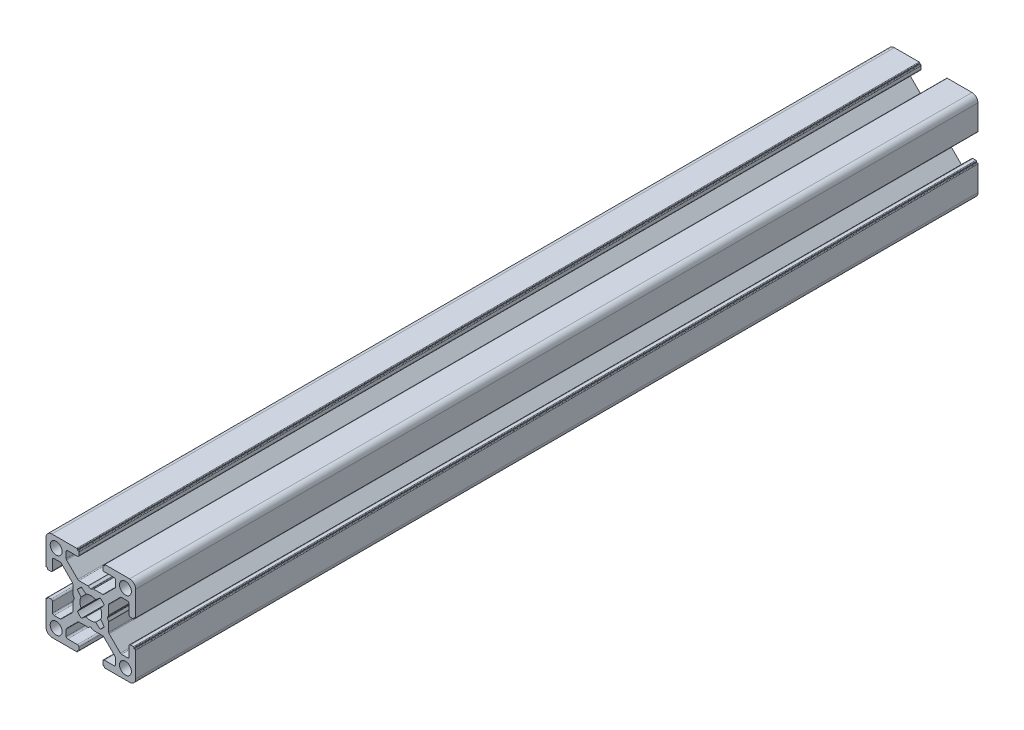
from build123d import *

# Parameters (mm, degrees)
CROQUIS1_R              = 2
SALIENTE_EXTRUIR1_DEPTH = 282


with BuildPart() as part:
    # Croquis1 → Saliente-Extruir1 (new body)
    with BuildSketch(Plane.XY.offset(1000)):
        with BuildLine():
            Line((9.800000436, -10.500000436), (10.100000436, -10.500000436))
            ThreePointArc((10.100000436, -10.500000436), (10.241421792, -10.441421792), (10.300000436, -10.300000436))
            Line((10.300000436, -10.300000436), (10.300000436, -2))
            ThreePointArc((10.300000436, -2), (9.714213998, -0.585786438), (8.300000436, 0))
            Line((8.300000436, 0), (0, 0))
            ThreePointArc((0, 0), (-0.141421356, -0.058578644), (-0.2, -0.2))
            Line((-0.2, -0.2), (-0.2, -0.5))
            Line((-0.2, -0.5), (-0.49999919, -0.5))
            ThreePointArc((-0.49999919, -0.5), (-0.641420811, -0.558578753), (-0.699999564, -0.700000374))
            Line((-0.699999564, -0.700000374), (-0.699999564, -1.700000763))
            ThreePointArc((-0.699999564, -1.700000763), (-0.553552955, -2.053554154), (-0.199999564, -2.200000763))
            Line((-0.199999564, -2.200000763), (3.050000763, -2.200000763))
            ThreePointArc((3.050000763, -2.200000763), (3.403554154, -2.346447372), (3.550000763, -2.700000763))
            Line((3.550000763, -2.700000763), (3.550000763, -4.743055509))
            ThreePointArc((3.550000763, -4.743055509), (3.511993279, -4.934269826), (3.403749103, -5.096413843))
            Line((3.403749103, -5.096413843), (-0.349053376, -8.853358334))
            ThreePointArc((-0.349053376, -8.853358334), (-0.511332616, -8.961886981), (-0.702801716, -9))
            Line((-0.702801716, -9), (-3.746809419, -9))
            ThreePointArc((-3.746809419, -9), (-3.798212795, -9.006718618), (-3.846162576, -9.026423071))
            Line((-3.846162576, -9.026423071), (-4.600646407, -9.458279719))
            ThreePointArc((-4.600646407, -9.458279719), (-4.699999564, -9.48470279), (-4.799352721, -9.458279719))
            Line((-4.799352721, -9.458279719), (-5.553836552, -9.026423071))
            ThreePointArc((-5.553836552, -9.026423071), (-5.601786333, -9.006718618), (-5.653189709, -9))
            Line((-5.653189709, -9), (-8.697197412, -9))
            ThreePointArc((-8.697197412, -9), (-8.888666513, -8.961886981), (-9.050945752, -8.853358334))
            Line((-9.050945752, -8.853358334), (-12.803748231, -5.096413843))
            ThreePointArc((-12.803748231, -5.096413843), (-12.911992407, -4.934269826), (-12.949999891, -4.743055509))
            Line((-12.949999891, -4.743055509), (-12.949999891, -2.700000763))
            ThreePointArc((-12.949999891, -2.700000763), (-12.803553282, -2.346447372), (-12.449999891, -2.200000763))
            Line((-12.449999891, -2.200000763), (-9.199999564, -2.200000763))
            ThreePointArc((-9.199999564, -2.200000763), (-8.846446173, -2.053554154), (-8.699999564, -1.700000763))
            Line((-8.699999564, -1.700000763), (-8.699999564, -0.700000374))
            ThreePointArc((-8.699999564, -0.700000374), (-8.758578317, -0.558578753), (-8.899999938, -0.5))
            Line((-8.899999938, -0.5), (-9.199999128, -0.5))
            Line((-9.199999128, -0.5), (-9.199999128, -0.2))
            ThreePointArc((-9.199999128, -0.2), (-9.258577772, -0.058578644), (-9.399999128, 0))
            Line((-9.399999128, 0), (-17.699999564, 0))
            ThreePointArc((-17.699999564, 0), (-19.114213126, -0.585786438), (-19.699999564, -2))
            Line((-19.699999564, -2), (-19.699999564, -10.300000436))
            ThreePointArc((-19.699999564, -10.300000436), (-19.64142092, -10.441421792), (-19.499999564, -10.500000436))
            Line((-19.499999564, -10.500000436), (-19.199999564, -10.500000436))
            Line((-19.199999564, -10.500000436), (-19.199999564, -10.799999627))
            ThreePointArc((-19.199999564, -10.799999627), (-19.141420811, -10.941421247), (-18.99999919, -11))
            Line((-18.99999919, -11), (-17.999998801, -11))
            ThreePointArc((-17.999998801, -11), (-17.64644541, -10.853553391), (-17.499998801, -10.5))
            Line((-17.499998801, -10.5), (-17.499998801, -7.249999673))
            ThreePointArc((-17.499998801, -7.249999673), (-17.353552192, -6.896446283), (-16.999998801, -6.749999673))
            Line((-16.999998801, -6.749999673), (-14.956944055, -6.749999673))
            ThreePointArc((-14.956944055, -6.749999673), (-14.765729738, -6.788007157), (-14.603585721, -6.896251334))
            Line((-14.603585721, -6.896251334), (-10.84664123, -10.649053813))
            ThreePointArc((-10.84664123, -10.649053813), (-10.738112583, -10.811333052), (-10.699999564, -11.002802152))
            Line((-10.699999564, -11.002802152), (-10.699999564, -14.046809855))
            ThreePointArc((-10.699999564, -14.046809855), (-10.693280947, -14.098213232), (-10.673576493, -14.146163012))
            Line((-10.673576493, -14.146163012), (-10.241719845, -14.900646843))
            ThreePointArc((-10.241719845, -14.900646843), (-10.215296774, -15), (-10.241719845, -15.099353157))
            Line((-10.241719845, -15.099353157), (-10.673576493, -15.853836988))
            ThreePointArc((-10.673576493, -15.853836988), (-10.693280947, -15.901786769), (-10.699999564, -15.953190146))
            Line((-10.699999564, -15.953190146), (-10.699999564, -18.997197848))
            ThreePointArc((-10.699999564, -18.997197848), (-10.738112583, -19.188666949), (-10.84664123, -19.350946188))
            Line((-10.84664123, -19.350946188), (-14.603585721, -23.103748667))
            ThreePointArc((-14.603585721, -23.103748667), (-14.765729738, -23.211992843), (-14.956944055, -23.250000327))
            Line((-14.956944055, -23.250000327), (-16.999998801, -23.250000327))
            ThreePointArc((-16.999998801, -23.250000327), (-17.353552192, -23.103553718), (-17.499998801, -22.750000327))
            Line((-17.499998801, -22.750000327), (-17.499998801, -19.5))
            ThreePointArc((-17.499998801, -19.5), (-17.64644541, -19.14644661), (-17.999998801, -19))
            Line((-17.999998801, -19), (-18.99999919, -19))
            ThreePointArc((-18.99999919, -19), (-19.141420811, -19.058578753), (-19.199999564, -19.200000374))
            Line((-19.199999564, -19.200000374), (-19.199999564, -19.499999564))
            Line((-19.199999564, -19.499999564), (-19.499999564, -19.499999564))
            ThreePointArc((-19.499999564, -19.499999564), (-19.64142092, -19.558578208), (-19.699999564, -19.699999564))
            Line((-19.699999564, -19.699999564), (-19.699999564, -28))
            ThreePointArc((-19.699999564, -28), (-19.114213126, -29.414213563), (-17.699999564, -30))
            Line((-17.699999564, -30), (-9.399999128, -30))
            ThreePointArc((-9.399999128, -30), (-9.258577772, -29.941421356), (-9.199999128, -29.8))
            Line((-9.199999128, -29.8), (-9.199999128, -29.5))
            Line((-9.199999128, -29.5), (-8.899999938, -29.5))
            ThreePointArc((-8.899999938, -29.5), (-8.758578317, -29.441421247), (-8.699999564, -29.299999627))
            Line((-8.699999564, -29.299999627), (-8.699999564, -28.299999237))
            ThreePointArc((-8.699999564, -28.299999237), (-8.846446173, -27.946445847), (-9.199999564, -27.799999237))
            Line((-9.199999564, -27.799999237), (-12.449999891, -27.799999237))
            ThreePointArc((-12.449999891, -27.799999237), (-12.803553282, -27.653552628), (-12.949999891, -27.299999237))
            Line((-12.949999891, -27.299999237), (-12.949999891, -25.256944491))
            ThreePointArc((-12.949999891, -25.256944491), (-12.911992407, -25.065730174), (-12.803748231, -24.903586157))
            Line((-12.803748231, -24.903586157), (-9.050945752, -21.146641666))
            ThreePointArc((-9.050945752, -21.146641666), (-8.888666513, -21.038113019), (-8.697197412, -21))
            Line((-8.697197412, -21), (-5.653189709, -21))
            ThreePointArc((-5.653189709, -21), (-5.601786333, -20.993281383), (-5.553836552, -20.973576929))
            Line((-5.553836552, -20.973576929), (-4.799352721, -20.541720281))
            ThreePointArc((-4.799352721, -20.541720281), (-4.699999564, -20.51529721), (-4.600646407, -20.541720281))
            Line((-4.600646407, -20.541720281), (-3.846162576, -20.973576929))
            ThreePointArc((-3.846162576, -20.973576929), (-3.798212795, -20.993281383), (-3.746809419, -21))
            Line((-3.746809419, -21), (-0.702801716, -21))
            ThreePointArc((-0.702801716, -21), (-0.511332616, -21.038113019), (-0.349053377, -21.146641666))
            Line((-0.349053377, -21.146641666), (3.403749103, -24.903586157))
            ThreePointArc((3.403749103, -24.903586157), (3.511993279, -25.065730174), (3.550000763, -25.256944491))
            Line((3.550000763, -25.256944491), (3.550000763, -27.299999237))
            ThreePointArc((3.550000763, -27.299999237), (3.403554154, -27.653552628), (3.050000763, -27.799999237))
            Line((3.050000763, -27.799999237), (-0.199999564, -27.799999237))
            ThreePointArc((-0.199999564, -27.799999237), (-0.553552955, -27.946445847), (-0.699999564, -28.299999237))
            Line((-0.699999564, -28.299999237), (-0.699999564, -29.299999627))
            ThreePointArc((-0.699999564, -29.299999627), (-0.641420811, -29.441421247), (-0.49999919, -29.5))
            Line((-0.49999919, -29.5), (-0.2, -29.5))
            Line((-0.2, -29.5), (-0.2, -29.8))
            ThreePointArc((-0.2, -29.8), (-0.141421356, -29.941421356), (0, -30))
            Line((0, -30), (8.300000436, -30))
            ThreePointArc((8.300000436, -30), (9.714213998, -29.414213563), (10.300000436, -28))
            Line((10.300000436, -28), (10.300000436, -19.699999564))
            ThreePointArc((10.300000436, -19.699999564), (10.241421792, -19.558578208), (10.100000436, -19.499999564))
            Line((10.100000436, -19.499999564), (9.800000436, -19.499999564))
            Line((9.800000436, -19.499999564), (9.800000436, -19.200000374))
            ThreePointArc((9.800000436, -19.200000374), (9.741421683, -19.058578753), (9.600000062, -19))
            Line((9.600000062, -19), (8.599999673, -19))
            ThreePointArc((8.599999673, -19), (8.246446283, -19.14644661), (8.099999673, -19.5))
            Line((8.099999673, -19.5), (8.099999673, -22.750000327))
            ThreePointArc((8.099999673, -22.750000327), (7.953553064, -23.103553718), (7.599999673, -23.250000327))
            Line((7.599999673, -23.250000327), (5.556944927, -23.250000327))
            ThreePointArc((5.556944927, -23.250000327), (5.36573061, -23.211992843), (5.203586593, -23.103748667))
            Line((5.203586593, -23.103748667), (1.446642102, -19.350946188))
            ThreePointArc((1.446642102, -19.350946188), (1.338113455, -19.188666949), (1.300000436, -18.997197848))
            Line((1.300000436, -18.997197848), (1.300000436, -15.953190145))
            ThreePointArc((1.300000436, -15.953190145), (1.293281819, -15.901786769), (1.273577365, -15.853836988))
            Line((1.273577365, -15.853836988), (0.841720717, -15.099353157))
            ThreePointArc((0.841720717, -15.099353157), (0.815297646, -15), (0.841720717, -14.900646843))
            Line((0.841720717, -14.900646843), (1.273577365, -14.146163012))
            ThreePointArc((1.273577365, -14.146163012), (1.293281819, -14.098213231), (1.300000436, -14.046809855))
            Line((1.300000436, -14.046809855), (1.300000436, -11.002802152))
            ThreePointArc((1.300000436, -11.002802152), (1.338113455, -10.811333052), (1.446642102, -10.649053813))
            Line((1.446642102, -10.649053813), (5.203586593, -6.896251334))
            ThreePointArc((5.203586593, -6.896251334), (5.36573061, -6.788007157), (5.556944927, -6.749999673))
            Line((5.556944927, -6.749999673), (7.599999673, -6.749999673))
            ThreePointArc((7.599999673, -6.749999673), (7.953553064, -6.896446283), (8.099999673, -7.249999673))
            Line((8.099999673, -7.249999673), (8.099999673, -10.5))
            ThreePointArc((8.099999673, -10.5), (8.246446283, -10.853553391), (8.599999673, -11))
            Line((8.599999673, -11), (9.600000062, -11))
            ThreePointArc((9.600000062, -11), (9.741421683, -10.941421247), (9.800000436, -10.799999627))
            Line((9.800000436, -10.799999627), (9.800000436, -10.500000436))
        make_face()
        with Locations((-16.300000272, -3.399999983)):
            Circle(CROQUIS1_R, mode=Mode.SUBTRACT)
        with Locations((6.900001145, -3.399999983)):
            Circle(CROQUIS1_R, mode=Mode.SUBTRACT)
        with Locations(Location((-16.300000272, -26.600000017, 0), (0, 0, 180))):
            Circle(CROQUIS1_R, mode=Mode.SUBTRACT)
        with Locations(Location((6.900001145, -26.600000017, 0), (0, 0, 180))):
            Circle(CROQUIS1_R, mode=Mode.SUBTRACT)
        with BuildLine():
            Line((-7.835928976, -10.481599097), (-6.300129088, -11.719438233))
            ThreePointArc((-6.300129088, -11.719438233), (-4.699999564, -11.35), (-3.09987004, -11.719438233))
            Line((-3.09987004, -11.719438233), (-1.564070152, -10.481599097))
            ThreePointArc((-1.564070152, -10.481599097), (-0.818997305, -11.10284444), (-0.194662672, -11.845330527))
            Line((-0.194662672, -11.845330527), (-1.419437832, -13.399870404))
            ThreePointArc((-1.419437832, -13.399870404), (-1.049999564, -15), (-1.419437832, -16.600129597))
            Line((-1.419437832, -16.600129597), (-0.194662672, -18.154669473))
            ThreePointArc((-0.194662672, -18.154669473), (-0.818997305, -18.897155561), (-1.564070152, -19.518400903))
            Line((-1.564070152, -19.518400903), (-3.09987004, -18.280561767))
            ThreePointArc((-3.09987004, -18.280561767), (-4.699999564, -18.65), (-6.300129088, -18.280561767))
            Line((-6.300129088, -18.280561767), (-7.835928976, -19.518400903))
            ThreePointArc((-7.835928976, -19.518400903), (-8.581001823, -18.897155561), (-9.205336456, -18.154669473))
            Line((-9.205336456, -18.154669473), (-7.980561295, -16.600129597))
            ThreePointArc((-7.980561295, -16.600129597), (-8.349999564, -15), (-7.980561296, -13.399870404))
            Line((-7.980561296, -13.399870404), (-9.205336456, -11.845330527))
            ThreePointArc((-9.205336456, -11.845330527), (-8.581001823, -11.10284444), (-7.835928976, -10.481599097))
        make_face(mode=Mode.SUBTRACT)
    extrude(amount=-SALIENTE_EXTRUIR1_DEPTH)


solid = part.part
